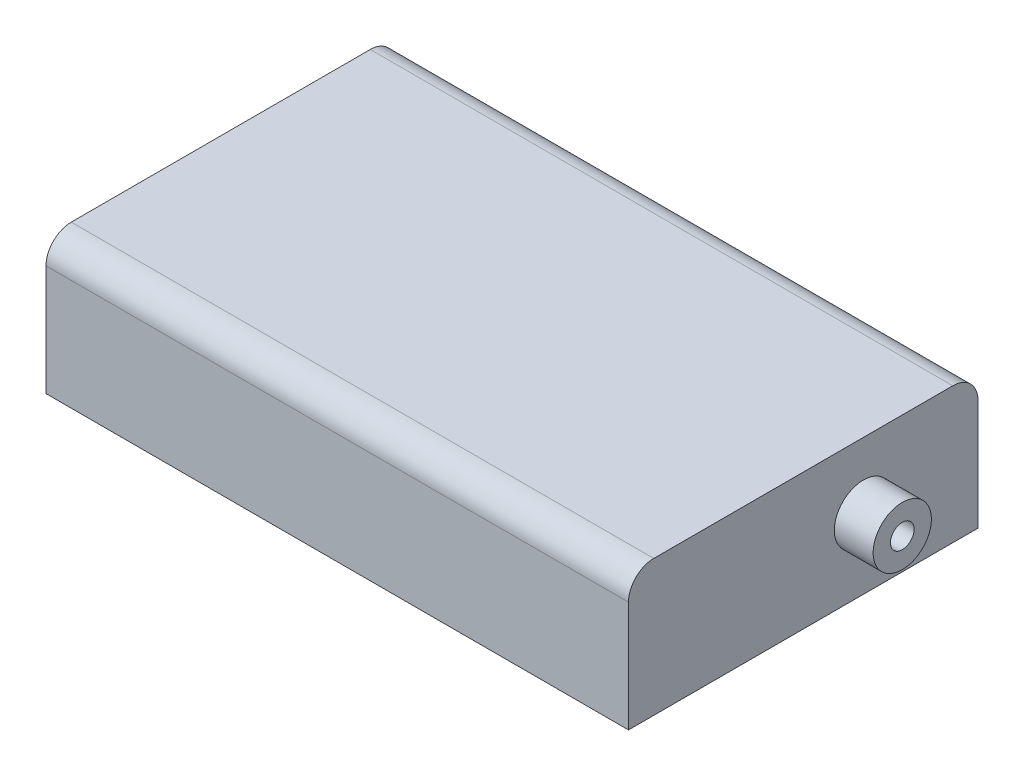
from build123d import *

# Parameters (mm, degrees)
SKETCH1_W             = 150
SKETCH1_H             = 90
BOSS_EXTRUDE1_DEPTH   = 35
SHELL2_T              = -2.5
SKETCH5_R             = 4
BOSS_EXTRUDE8_DEPTH   = 32.5
SKETCH6_R             = 1.25
CUT_EXTRUDE1_DEPTH    = 12
SKETCH6_3_R           = 1.25
CUT_EXTRUDE2_DEPTH    = 12
FILLET1_R             = 6.5
FILLET2_R             = 6.5
SKETCH22_R            = 3
SKETCH22_R_2          = 1.25
ESP32_SCREWHOLE_DEPTH = 4
SKETCH25_R            = 3
SKETCH25_R_2          = 1.25
BOSS_EXTRUDE11_DEPTH  = 4
GUIDE_HW_DEPTH        = 5
BOSS_EXTRUDE13_DEPTH  = 16.5
SKETCH33_W            = 23
SKETCH33_H            = 2
BOSS_EXTRUDE14_DEPTH  = 10
SKETCH36_R            = 9.5
CUT_EXTRUDE8_DEPTH    = 2
CUT_EXTRUDE9_START    = -2
SKETCH37_R            = 9.5
CUT_EXTRUDE9_DEPTH    = 2
SKETCH38_R            = 7.5
SKETCH38_R_2          = 3.05
BOSS_EXTRUDE15_DEPTH  = 10
SKETCH40_W            = 1.5
SKETCH40_H            = 15
CUT_EXTRUDE10_DEPTH   = 2.5
SKETCH41_W            = 12
SKETCH41_H            = 7
CUT_EXTRUDE11_DEPTH   = 2.5
SKETCH42_W            = 12
SKETCH42_H            = 7
CUT_EXTRUDE12_DEPTH   = 2.5
SKETCH45_W            = 2
SKETCH45_H            = 32
BOSS_EXTRUDE16_DEPTH  = 25
SKETCH47_R            = 3
CUT_EXTRUDE13_DEPTH   = 2.5
SKETCH43_R            = 10.25
SKETCH43_R_2          = 8.75
BOSS_EXTRUDE18_DEPTH  = 45


with BuildPart() as part:
    # Sketch1 → Boss-Extrude1 (new body)
    with BuildSketch(Plane(origin=(0, 0, 0), x_dir=(1, 0, 0), z_dir=(0, 1, 0))):
        with Locations((75, 45)):
            Rectangle(SKETCH1_W, SKETCH1_H)
    extrude(amount=BOSS_EXTRUDE1_DEPTH)

    # Shell2
    shell2_openings = [part.faces().sort_by_distance(p)[0] for p in [
        (75, 0, -45),
    ]]
    offset(amount=SHELL2_T, openings=shell2_openings, kind=Kind.INTERSECTION)

    # Sketch5 → Boss-Extrude8 (add)
    with BuildSketch(Plane(origin=(0, 32.5, 0), x_dir=(-1, 0, 0), z_dir=(0, -1, 0))):
        with Locations((-8.5, 81.5)):
            Circle(SKETCH5_R)
        with Locations((-8.5, 8.5)):
            Circle(SKETCH5_R)
        with Locations((-141.5, 81.5)):
            Circle(SKETCH5_R)
        with Locations((-141.5, 8.5)):
            Circle(SKETCH5_R)
    extrude(amount=BOSS_EXTRUDE8_DEPTH)

    # Sketch6 → Cut-Extrude1 (cut)
    with BuildSketch(Plane.XZ):
        with Locations((8.5, -81.5)):
            Circle(SKETCH6_R)
    extrude(amount=-CUT_EXTRUDE1_DEPTH, mode=Mode.SUBTRACT)

    # Sketch6<3> → Cut-Extrude2 (cut)
    with BuildSketch(Plane.XZ):
        with Locations((141.5, -81.5)):
            Circle(SKETCH6_3_R)
        with Locations((141.5, -8.5)):
            Circle(SKETCH6_3_R)
        with Locations((8.5, -8.5)):
            Circle(SKETCH6_3_R)
    extrude(amount=-CUT_EXTRUDE2_DEPTH, mode=Mode.SUBTRACT)

    # Fillet1
    fillet1_edges = [part.edges().sort_by_distance(p)[0] for p in [
        (75, 35, 0),
    ]]
    fillet(fillet1_edges, radius=FILLET1_R)

    # Fillet2
    fillet2_edges = [part.edges().sort_by_distance(p)[0] for p in [
        (75, 35, -90),
    ]]
    fillet(fillet2_edges, radius=FILLET2_R)

    # Sketch22 → ESP32-screwhole (add)
    # profile 1 of 4: a face of its own
    with BuildSketch(Plane.XZ.offset(-32.5)):
        with Locations((82.9, -36.1)):
            Circle(SKETCH22_R)
        with Locations((82.9, -36.1)):
            Circle(SKETCH22_R_2, mode=Mode.SUBTRACT)
    # profile 2 of 4: a face of its own
    with BuildSketch(Plane.XZ.offset(-32.5)):
        with Locations((82.9, -9.9)):
            Circle(SKETCH22_R)
        with Locations((82.9, -9.9)):
            Circle(SKETCH22_R_2, mode=Mode.SUBTRACT)
    # profile 3 of 4: a face of its own
    with BuildSketch(Plane.XZ.offset(-32.5)):
        with Locations((131.1, -9.9)):
            Circle(SKETCH22_R)
        with Locations((131.1, -9.9)):
            Circle(SKETCH22_R_2, mode=Mode.SUBTRACT)
    # profile 4 of 4: a face of its own
    with BuildSketch(Plane.XZ.offset(-32.5)):
        with Locations((131.1, -36.1)):
            Circle(SKETCH22_R)
        with Locations((131.1, -36.1)):
            Circle(SKETCH22_R_2, mode=Mode.SUBTRACT)
    extrude(amount=ESP32_SCREWHOLE_DEPTH)

    # Sketch25 → Boss-Extrude11 (add)
    # profile 1 of 4: a face of its own
    with BuildSketch(Plane.XZ.offset(-32.5)):
        with Locations((6, -70.5)):
            Circle(SKETCH25_R)
        with Locations((6, -70.5)):
            Circle(SKETCH25_R_2, mode=Mode.SUBTRACT)
    # profile 2 of 4: a face of its own
    with BuildSketch(Plane.XZ.offset(-32.5)):
        with Locations((6, -57.5)):
            Circle(SKETCH25_R)
        with Locations((6, -57.5)):
            Circle(SKETCH25_R_2, mode=Mode.SUBTRACT)
    # profile 3 of 4: a face of its own
    with BuildSketch(Plane.XZ.offset(-32.5)):
        with Locations((38, -57.5)):
            Circle(SKETCH25_R)
        with Locations((38, -57.5)):
            Circle(SKETCH25_R_2, mode=Mode.SUBTRACT)
    # profile 4 of 4: a face of its own
    with BuildSketch(Plane.XZ.offset(-32.5)):
        with Locations((38, -70.5)):
            Circle(SKETCH25_R)
        with Locations((38, -70.5)):
            Circle(SKETCH25_R_2, mode=Mode.SUBTRACT)
    extrude(amount=BOSS_EXTRUDE11_DEPTH)

    # Sketch30 → guide HW (add)
    with BuildSketch(Plane.XZ.offset(-32.5)):
        Polygon((2.5, -52), (28.1, -52), (28.1, -32.4), (2.5, -32.4), (2.5, -30.9), (29.6, -30.9), (29.6, -53.5), (2.5, -53.5), align=None)
    extrude(amount=GUIDE_HW_DEPTH)

    # Sketch32 → Boss-Extrude13 (add)
    with BuildSketch(Plane.XZ.offset(-32.5)):
        Polygon((2.5, -29.4), (8.9, -29.4), (8.9, -16.2), (2.5, -16.2), (2.5, -14.7), (10.4, -14.7), (10.4, -30.9), (2.5, -30.9), align=None)
    extrude(amount=BOSS_EXTRUDE13_DEPTH)

    # Sketch33 → Boss-Extrude14 (add)
    with BuildSketch(Plane.XZ.offset(-32.5)):
        with Locations((57.5, -76.5)):
            Rectangle(SKETCH33_W, SKETCH33_H)
        with Locations((57.5, -11.5)):
            Rectangle(SKETCH33_W, SKETCH33_H)
    extrude(amount=BOSS_EXTRUDE14_DEPTH)

    # Sketch36 → Cut-Extrude8 (cut)
    with BuildSketch(Plane.XY.offset(-75.5)):
        with Locations((57.5, 22.5)):
            Circle(SKETCH36_R)
    extrude(amount=-CUT_EXTRUDE8_DEPTH, mode=Mode.SUBTRACT)

    # Sketch37 → Cut-Extrude9 (cut)
    with BuildSketch(Plane(origin=(0, 0, -12.5), x_dir=(-1, 0, 0), z_dir=(0, 0, -1)).offset(CUT_EXTRUDE9_START)):
        with Locations((-57.5, 22.5)):
            Circle(SKETCH37_R)
    extrude(amount=CUT_EXTRUDE9_DEPTH, mode=Mode.SUBTRACT)

    # Sketch38 → Boss-Extrude15 (add)
    with BuildSketch(Plane(origin=(150, 0, 0), x_dir=(0, 0, -1), z_dir=(1, 0, 0))):
        with Locations((60.5, 18)):
            Circle(SKETCH38_R)
        with Locations((60.5, 18)):
            Circle(SKETCH38_R_2, mode=Mode.SUBTRACT)
    extrude(amount=BOSS_EXTRUDE15_DEPTH)

    # Sketch40 → Cut-Extrude10 (cut)
    with BuildSketch(Plane.ZY):
        with Locations((-28.65, 24)):
            Rectangle(SKETCH40_W, SKETCH40_H)
        with Locations((-25.65, 24)):
            Rectangle(SKETCH40_W, SKETCH40_H)
        with Locations((-22.65, 24)):
            Rectangle(SKETCH40_W, SKETCH40_H)
        with Locations((-19.65, 24)):
            Rectangle(SKETCH40_W, SKETCH40_H)
        with Locations((-16.65, 24)):
            Rectangle(SKETCH40_W, SKETCH40_H)
    extrude(amount=-CUT_EXTRUDE10_DEPTH, mode=Mode.SUBTRACT)

    # Sketch41 → Cut-Extrude11 (cut)
    with BuildSketch(Plane.ZY):
        with Locations((-41.7, 26.5)):
            Rectangle(SKETCH41_W, SKETCH41_H)
    extrude(amount=-CUT_EXTRUDE11_DEPTH, mode=Mode.SUBTRACT)

    # Sketch42 → Cut-Extrude12 (cut)
    with BuildSketch(Plane.ZY):
        with Locations((-64, 24)):
            Rectangle(SKETCH42_W, SKETCH42_H)
    extrude(amount=-CUT_EXTRUDE12_DEPTH, mode=Mode.SUBTRACT)

    # Sketch45 → Boss-Extrude16 (add)
    with BuildSketch(Plane.XZ.offset(-32.5)):
        with Locations((86.5, -63.5)):
            Rectangle(SKETCH45_W, SKETCH45_H)
    extrude(amount=BOSS_EXTRUDE16_DEPTH)

    # Sketch47 → Cut-Extrude13 (cut)
    with BuildSketch(Plane.ZY.offset(-147.5)):
        with Locations((-60.5, 18)):
            Circle(SKETCH47_R)
    extrude(amount=-CUT_EXTRUDE13_DEPTH, mode=Mode.SUBTRACT)

    # Sketch43 → Boss-Extrude18 (add)
    with BuildSketch(Plane.ZY.offset(-147.5)):
        with Locations((-60.5, 18)):
            Circle(SKETCH43_R)
        with Locations((-60.5, 18)):
            Circle(SKETCH43_R_2, mode=Mode.SUBTRACT)
    extrude(amount=BOSS_EXTRUDE18_DEPTH)


solid = part.part
